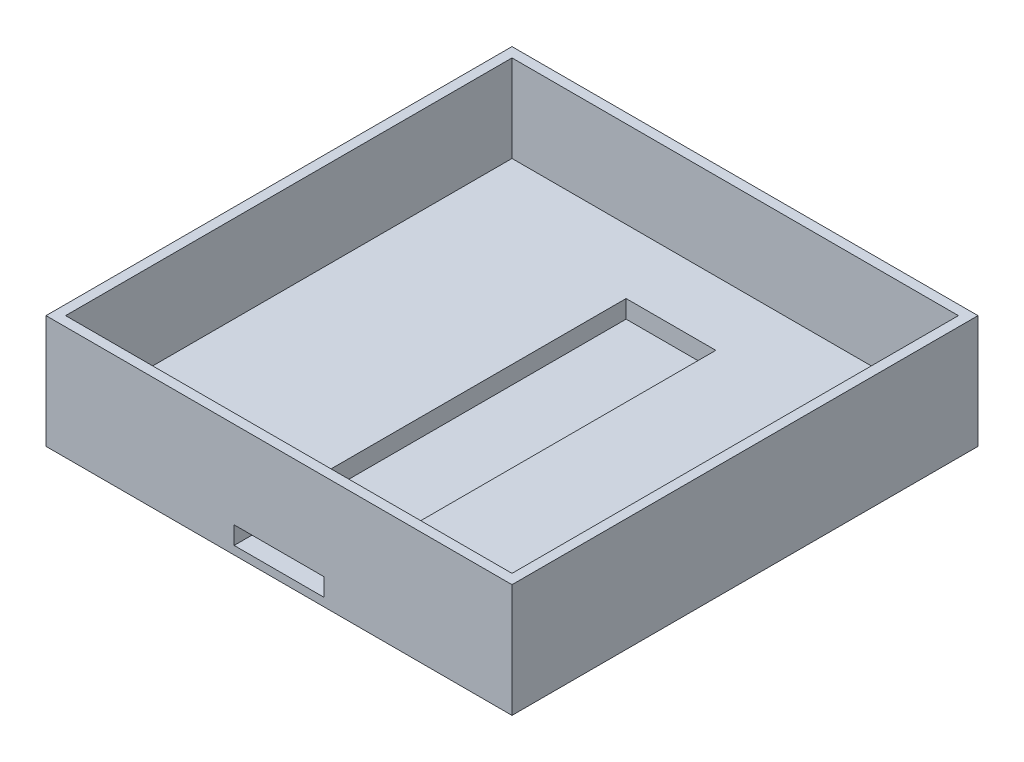
from build123d import *

# Parameters (mm, degrees)
SKETCH2_W           = 107
SKETCH2_H           = 107
BOSS_EXTRUDE1_DEPTH = 8
SKETCH14_W          = 107
SKETCH14_H          = 107
BOSS_EXTRUDE2_DEPTH = 18
SKETCH15_W          = 102.5
SKETCH15_H          = 102.5
CUT_EXTRUDE4_DEPTH  = 20
SKETCH12_W          = 20.6
SKETCH12_H          = 90.000135975
CUT_EXTRUDE3_DEPTH  = 4.1


with BuildPart() as part:
    # Sketch2 → Boss-Extrude1 (new body)
    with BuildSketch(Plane(origin=(0, 0, 0), x_dir=(1, 0, 0), z_dir=(0, 1, 0))):
        Rectangle(SKETCH2_W, SKETCH2_H)
    extrude(amount=BOSS_EXTRUDE1_DEPTH)

    # Sketch14 → Boss-Extrude2 (add)
    with BuildSketch(Plane(origin=(0, 8, 0), x_dir=(1, 0, 0), z_dir=(0, 1, 0))):
        Rectangle(SKETCH14_W, SKETCH14_H)
    extrude(amount=BOSS_EXTRUDE2_DEPTH)

    # Sketch15 → Cut-Extrude4 (cut)
    with BuildSketch(Plane(origin=(0, 26, 0), x_dir=(1, 0, 0), z_dir=(0, 1, 0))):
        Rectangle(SKETCH15_W, SKETCH15_H)
    extrude(amount=-CUT_EXTRUDE4_DEPTH, mode=Mode.SUBTRACT)

    # Sketch12 → Cut-Extrude3 (cut)
    with BuildSketch(Plane(origin=(0, 6, 0), x_dir=(1, 0, 0), z_dir=(0, 1, 0))):
        with Locations((0, -8.499932013)):
            Rectangle(SKETCH12_W, SKETCH12_H)
    extrude(amount=-CUT_EXTRUDE3_DEPTH, mode=Mode.SUBTRACT)


solid = part.part
